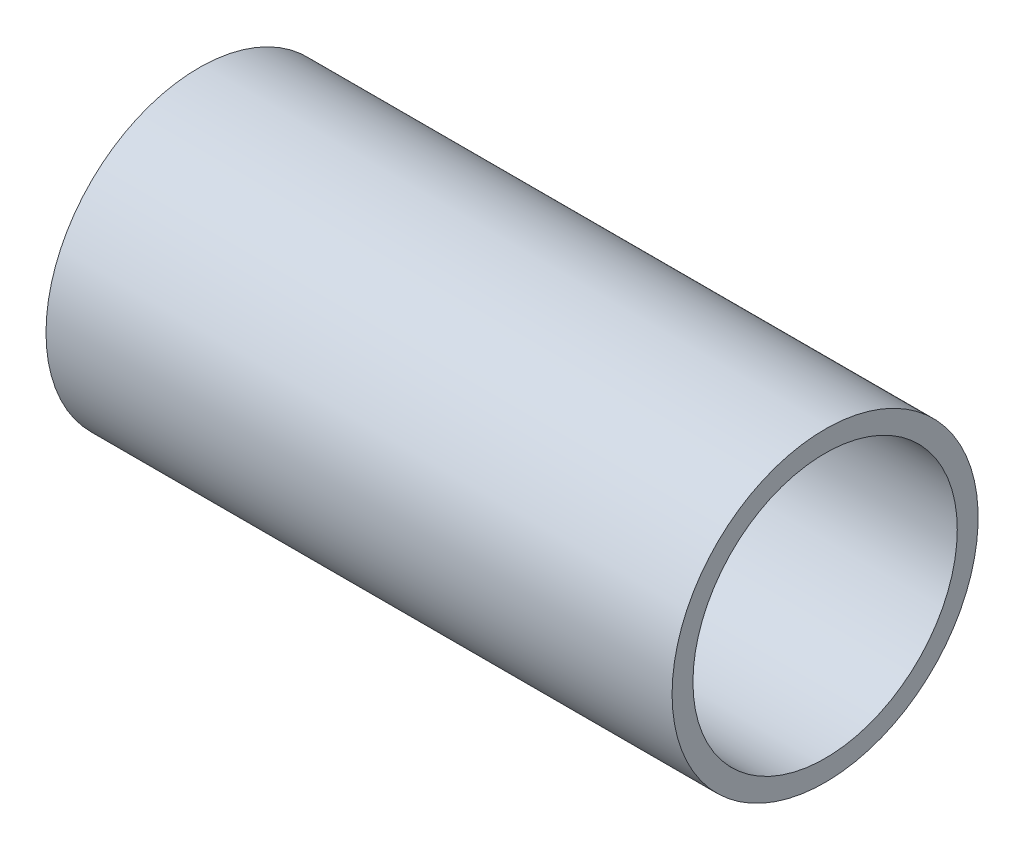
from build123d import *

# Parameters (mm, degrees)
SKETCH1_R           = 11
SKETCH1_R_2         = 9.5
BOSS_EXTRUDE1_DEPTH = 45


with BuildPart() as part:
    # Sketch1 → Boss-Extrude1 (new body)
    with BuildSketch(Plane(origin=(0, 0, 0), x_dir=(0, 0, -1), z_dir=(1, 0, 0))):
        with Locations(Location((0, 0, 0), (0, 0, 180))):
            Circle(SKETCH1_R)
        with Locations(Location((0, 0, 0), (0, 0, 180))):
            Circle(SKETCH1_R_2, mode=Mode.SUBTRACT)
    extrude(amount=BOSS_EXTRUDE1_DEPTH)


solid = part.part
